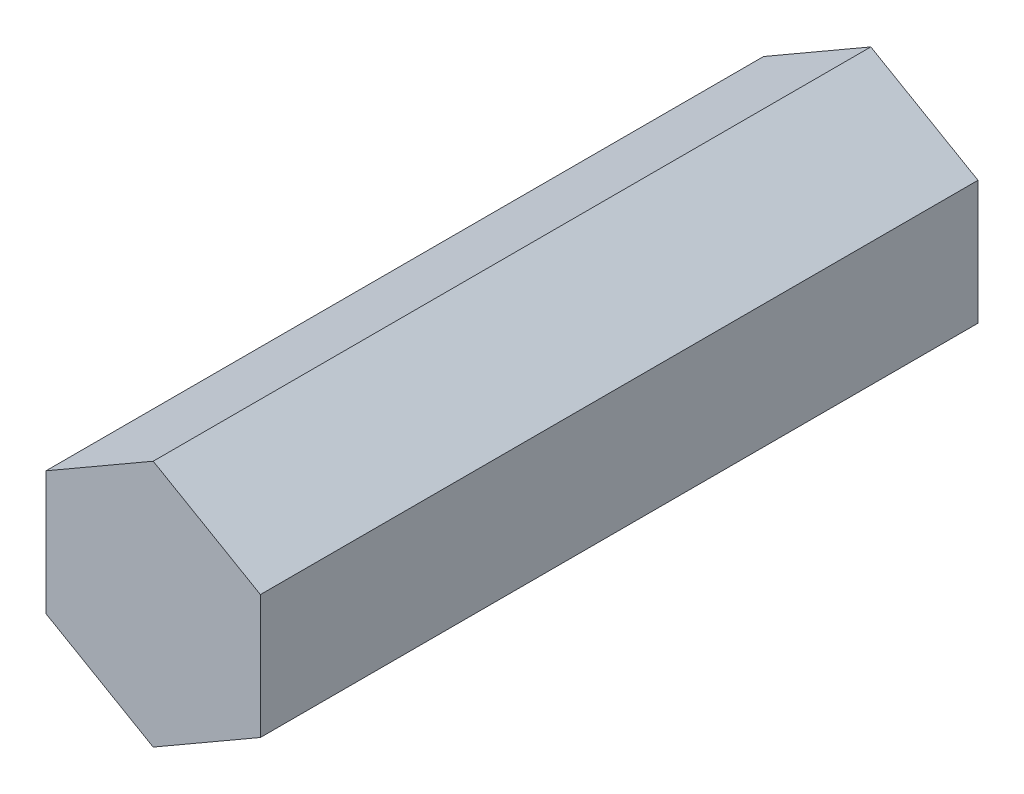
from build123d import *

# Parameters (mm, degrees)
BOSS_EXTRUDE1_DEPTH = 40


with BuildPart() as part:
    # Sketch1 → Boss-Extrude1 (new body)
    with BuildSketch(Plane.XY):
        Polygon((0, 6.9), (-5.975575286, 3.45), (-5.975575286, -3.45), (0, -6.9), (5.975575286, -3.45), (5.975575286, 3.45), align=None)
    extrude(amount=BOSS_EXTRUDE1_DEPTH)


solid = part.part
